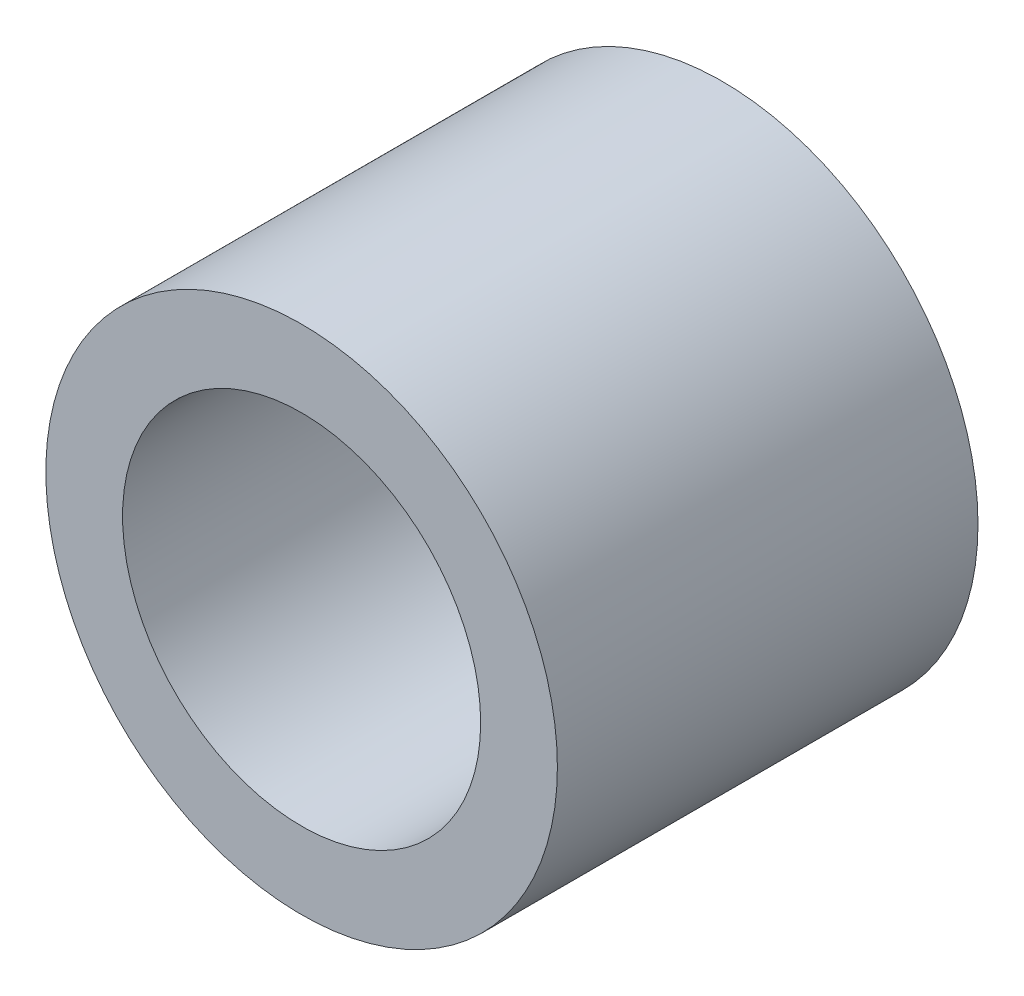
from build123d import *

# Parameters (mm, degrees)
SKETCH1_R           = 4.5
SKETCH1_R_2         = 3.15
BOSS_EXTRUDE1_DEPTH = 7.4


with BuildPart() as part:
    # Sketch1 → Boss-Extrude1 (new body)
    with BuildSketch(Plane(origin=(0, 0, 0), x_dir=(0, 1, 0), z_dir=(0, 0, 1))):
        with Locations(Location((0, 0, 0), (0, 0, 270))):
            Circle(SKETCH1_R)
        with Locations(Location((0, 0, 0), (0, 0, 270))):
            Circle(SKETCH1_R_2, mode=Mode.SUBTRACT)
    extrude(amount=BOSS_EXTRUDE1_DEPTH)


solid = part.part
